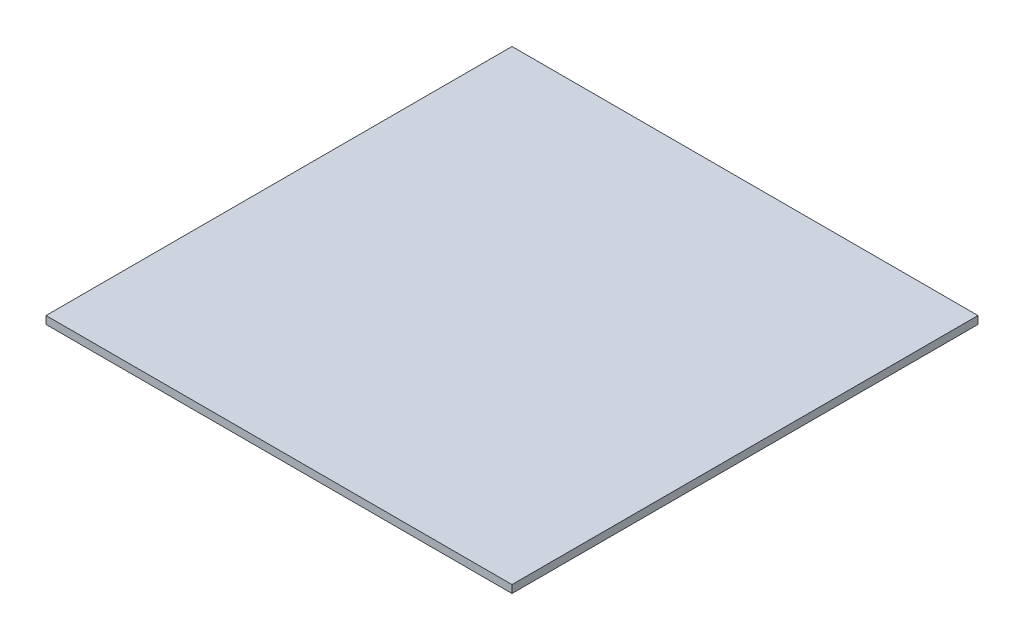
from build123d import *

# Parameters (mm, degrees)
SKETCH1_W           = 300
SKETCH1_H           = 300
BOSS_EXTRUDE1_DEPTH = 5


with BuildPart() as part:
    # Sketch1 → Boss-Extrude1 (new body)
    with BuildSketch(Plane(origin=(0, 0, 0), x_dir=(1, 0, 0), z_dir=(0, 1, 0))):
        with Locations((-14.782860196, -49.121405751)):
            Rectangle(SKETCH1_W, SKETCH1_H)
    extrude(amount=BOSS_EXTRUDE1_DEPTH)


solid = part.part
